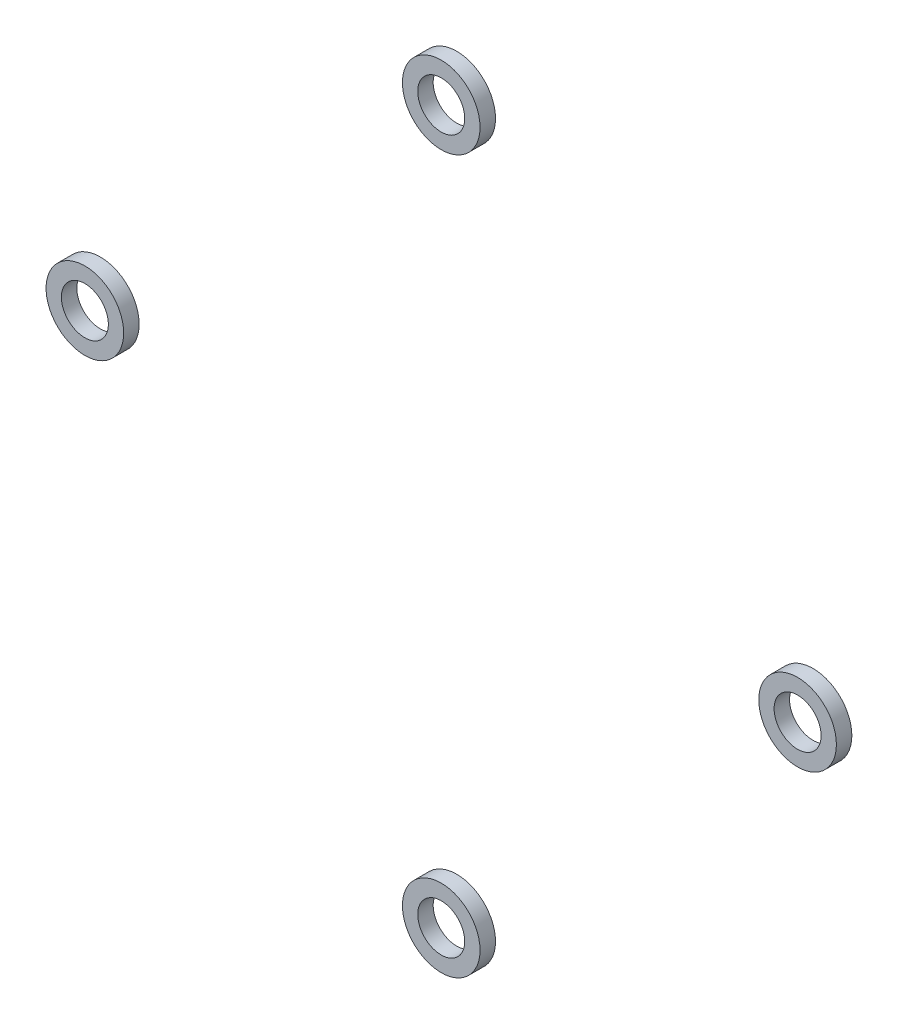
from build123d import *

# Parameters (mm, degrees)
SKETCH_1_R        = 2.51
SKETCH_1_R_2      = 1.52
EXTRUDE_1_DEPTH   = 1
EXTRUDE_1_2_DEPTH = 1
EXTRUDE_1_3_DEPTH = 1
EXTRUDE_1_4_DEPTH = 1


with BuildPart() as part:
    # 草图1 → 凸台-拉伸1 (new body)
    with BuildSketch(Plane.XY.offset(53)):
        with Locations((-24.698490112, 21.537847164)):
            Circle(SKETCH_1_R)
        with Locations((-24.698490112, 21.537847164)):
            Circle(SKETCH_1_R_2, mode=Mode.SUBTRACT)
    extrude(amount=EXTRUDE_1_DEPTH)


with BuildPart() as body_2:
    # 草图1 → Extrude 1 2 (new body)
    with BuildSketch(Plane.XY.offset(53)):
        with Locations((-1.648490492, -1.512152456)):
            Circle(SKETCH_1_R)
        with Locations((-1.648490492, -1.512152456)):
            Circle(SKETCH_1_R_2, mode=Mode.SUBTRACT)
    extrude(amount=EXTRUDE_1_2_DEPTH)


with BuildPart() as body_3:
    # 草图1 → Extrude 1 3 (new body)
    with BuildSketch(Plane.XY.offset(53)):
        with Locations((-24.698490112, -24.562152076)):
            Circle(SKETCH_1_R)
        with Locations((-24.698490112, -24.562152076)):
            Circle(SKETCH_1_R_2, mode=Mode.SUBTRACT)
    extrude(amount=EXTRUDE_1_3_DEPTH)


with BuildPart() as body_4:
    # 草图1 → Extrude 1 4 (new body)
    with BuildSketch(Plane.XY.offset(53)):
        with Locations((-47.748489732, -1.512152456)):
            Circle(SKETCH_1_R)
        with Locations((-47.748489732, -1.512152456)):
            Circle(SKETCH_1_R_2, mode=Mode.SUBTRACT)
    extrude(amount=EXTRUDE_1_4_DEPTH)


solid = Compound([part.part, body_2.part, body_3.part, body_4.part])
